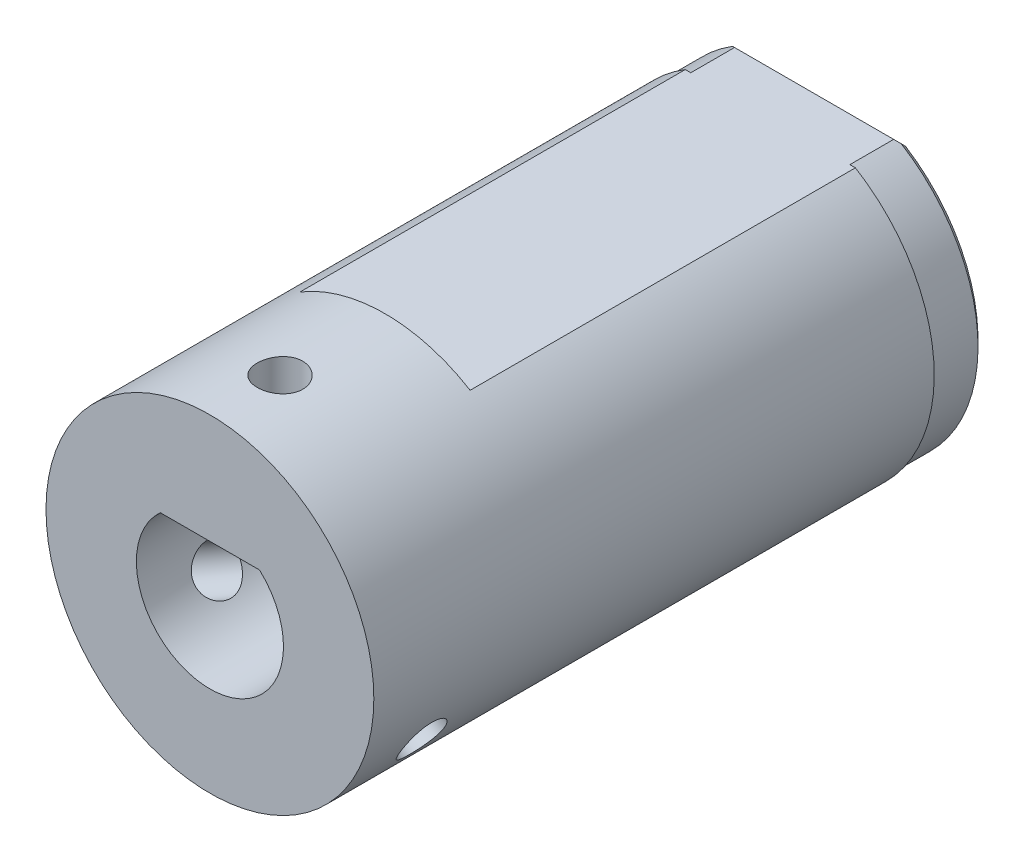
from build123d import *

# Parameters (mm, degrees)
SKETCH_2_R               = 9.36
SKETCH_2_R_2             = 4.2
EXTRUDE_1_DEPTH          = 35
EXTRUDE_START            = -10
EXTRUDE_2_DEPTH          = 10
CUT_EXTRUDE_1_REACH      = 42.78
SKETCH_3_R               = 1.3
PATTERN_CIRCULAR_1_COUNT = 3
CUT_EXTRUDE_2_DEPTH      = 25
CHAMFER_1_SIZE           = 0.5
SKETCH_7_R               = 9.5
SKETCH_7_R_2             = 9.2
CUT_EXTRUDE_3_DEPTH      = 3


with BuildPart() as part:
    # Эскиз2 → Бобышка-Вытянуть1 (new body)
    with BuildSketch(Plane.XY):
        Circle(SKETCH_2_R)
        Circle(SKETCH_2_R_2, mode=Mode.SUBTRACT)
    extrude(amount=EXTRUDE_1_DEPTH)

    # Эскиз4 → Бобышка-Вытянуть2 (add)
    with BuildSketch(Plane.XY.offset(35).offset(EXTRUDE_START)):
        with BuildLine():
            Line((-2.833725463, 3.1), (2.833725463, 3.1))
            ThreePointArc((2.833725463, 3.1), (0, 4.2), (-2.833725463, 3.1))
        make_face()
    extrude(amount=EXTRUDE_2_DEPTH)

    # Эскиз3 → Вырез-Вытянуть1 (cut, up to next)
    with BuildSketch(Plane(origin=(0, 9.36, 0), x_dir=(1, 0, 0), z_dir=(0, 1, 0)), mode=Mode.PRIVATE) as cut_extrude_1_sk1:
        with Locations(Location((0, -31, 0), (0, 0, 270))):
            Circle(SKETCH_3_R)
    cut_extrude_1_tool1 = extrude(cut_extrude_1_sk1.sketch, amount=-CUT_EXTRUDE_1_REACH, mode=Mode.PRIVATE) & part.part
    cut_extrude_1 = cut_extrude_1_tool1.solids().sort_by_distance((0, 9.36, 31))[0]
    add(cut_extrude_1, mode=Mode.SUBTRACT)

    # Круговой массив1: Вырез-Вытянуть1 ×3 about axis
    pattern_circular_1_axis = Axis((0, 0, 35), (0, 0, -1))
    for i in range(1, PATTERN_CIRCULAR_1_COUNT):
        add(cut_extrude_1.rotate(pattern_circular_1_axis, i * 360 / PATTERN_CIRCULAR_1_COUNT), mode=Mode.SUBTRACT)

    # Эскиз5 → Вырез-Вытянуть2 (cut)
    with BuildSketch(Plane(origin=(0, 0, 0), x_dir=(-1, 0, 0), z_dir=(0, 0, -1))):
        with BuildLine():
            Line((-4.858971084, 8), (4.858971084, 8))
            ThreePointArc((4.858971084, 8), (0, 9.36), (-4.858971084, 8))
        make_face()
    extrude(amount=-CUT_EXTRUDE_2_DEPTH, mode=Mode.SUBTRACT)

    # Фаска1
    chamfer_1_edges = [part.edges().sort_by_distance(p)[0] for p in [
        (-4.589642178, -8.157498678, 0),
        (0, 8, 0),
    ]]
    chamfer(chamfer_1_edges, length=CHAMFER_1_SIZE)

    # Эскиз7 → Вырез-Вытянуть3 (cut)
    with BuildSketch(Plane(origin=(0, 0, 0), x_dir=(-1, 0, 0), z_dir=(0, 0, -1))):
        Circle(SKETCH_7_R)
        Circle(SKETCH_7_R_2, mode=Mode.SUBTRACT)
    extrude(amount=-CUT_EXTRUDE_3_DEPTH, mode=Mode.SUBTRACT)


solid = part.part
